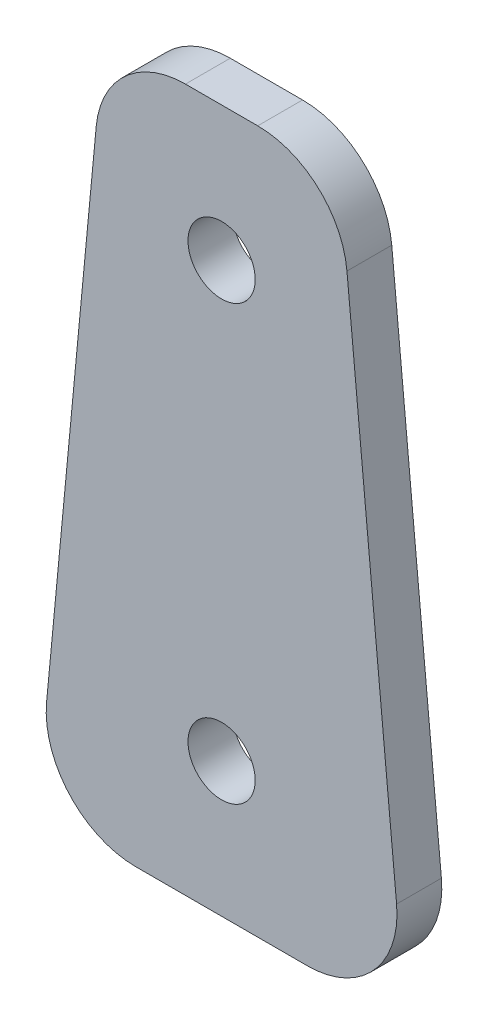
from build123d import *

# Parameters (mm, degrees)
SKETCH1_R           = 2.38125
BOSS_EXTRUDE1_DEPTH = 3.175


with BuildPart() as part:
    # Sketch1 → Boss-Extrude1 (new body)
    with BuildSketch(Plane.XY):
        with BuildLine():
            Line((36.211507542, 120.360465924), (32.694921335, 157.444465924))
            ThreePointArc((32.694921335, 157.444465924), (30.646212421, 161.542292232), (26.373280677, 163.195))
            Line((26.373280677, 163.195), (21.251719323, 163.195))
            ThreePointArc((21.251719323, 163.195), (16.978787579, 161.542292232), (14.930078665, 157.444465924))
            Line((14.930078665, 157.444465924), (11.413492458, 120.360465924))
            ThreePointArc((11.413492458, 120.360465924), (13.037840884, 115.488068256), (17.735133116, 113.411))
            Line((17.735133116, 113.411), (29.889866884, 113.411))
            ThreePointArc((29.889866884, 113.411), (34.587159116, 115.488068256), (36.211507542, 120.360465924))
        make_face()
        with Locations((23.8125, 122.936)):
            Circle(SKETCH1_R, mode=Mode.SUBTRACT)
        with Locations((23.8125, 153.67)):
            Circle(SKETCH1_R, mode=Mode.SUBTRACT)
    extrude(amount=BOSS_EXTRUDE1_DEPTH)


solid = part.part
